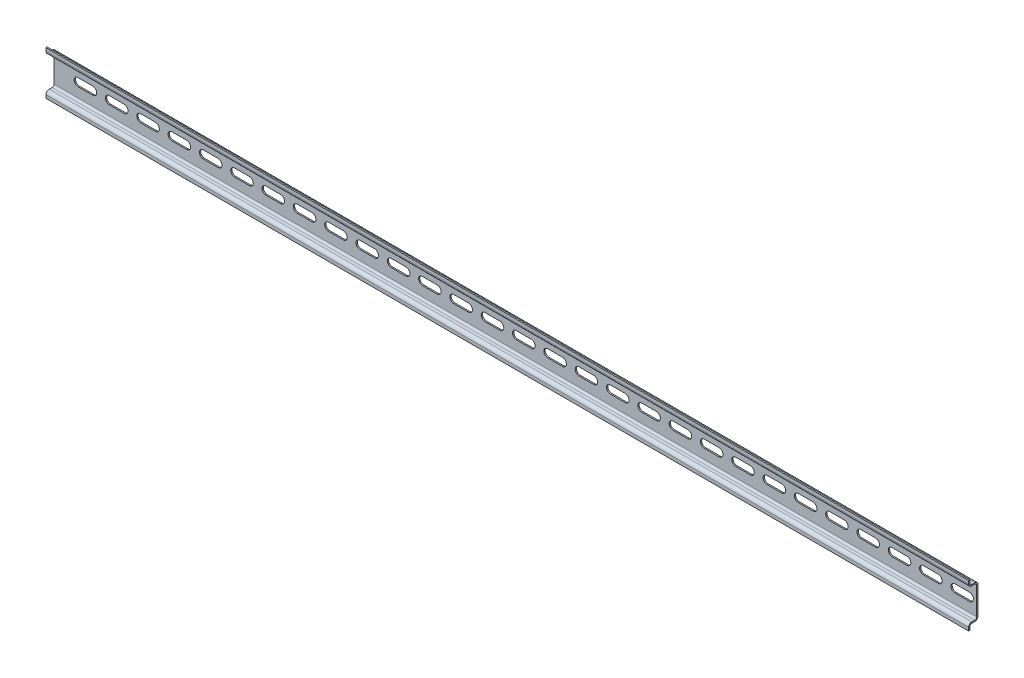
from build123d import *

# Parameters (mm, degrees)
BOSS_EXTRUDE1_DEPTH     = 1000
CUT_EXTRUDE1_DEPTH      = 1001.181688833
FILLET1_R               = 2.54
FILLET2_R               = 1.524
CUT_EXTRUDE2_DEPTH      = 1001.181688833
CUT_EXTRUDE2_DEPTH_BACK = 1001.181688833
SKETCH3_W               = 263.4
SKETCH3_H               = 35.052


with BuildPart() as part:
    # Sketch1 → Boss-Extrude1 (new body)
    with BuildSketch(Plane(origin=(0, 0, 0), x_dir=(0, 0, -1), z_dir=(1, 0, 0))):
        Polygon((0, 12.446), (0, -12.446), (-6.484, -12.446), (-6.484, -17.526), (-5.484, -17.526), (-5.484, -13.462), (1.016, -13.462), (1.016, 13.462), (-5.484, 13.462), (-5.484, 17.526), (-6.484, 17.526), (-6.484, 12.446), align=None)
    extrude(amount=BOSS_EXTRUDE1_DEPTH)

    # Sketch2 → Cut-Extrude1 (cut, through all)
    with BuildSketch(Plane(origin=(0, 0, -1.016), x_dir=(-1, 0, 0), z_dir=(0, 0, -1))):
        with BuildLine():
            Line((-980.825, 3.175), (-969.175, 3.175))
            ThreePointArc((-969.175, 3.175), (-966, 0), (-969.175, -3.175))
            Line((-969.175, -3.175), (-980.825, -3.175))
            ThreePointArc((-980.825, -3.175), (-984, 0), (-980.825, 3.175))
        make_face()
        with BuildLine():
            Line((-955.824999962, 3.175), (-944.174999962, 3.175))
            ThreePointArc((-944.174999962, 3.175), (-940.999999962, 0), (-944.174999962, -3.175))
            Line((-944.174999962, -3.175), (-955.824999962, -3.175))
            ThreePointArc((-955.824999962, -3.175), (-958.999999962, 0), (-955.824999962, 3.175))
        make_face()
        with BuildLine():
            Line((-930.824999924, 3.175), (-919.174999924, 3.175))
            ThreePointArc((-919.174999924, 3.175), (-915.999999924, 0), (-919.174999924, -3.175))
            Line((-919.174999924, -3.175), (-930.824999924, -3.175))
            ThreePointArc((-930.824999924, -3.175), (-933.999999924, 0), (-930.824999924, 3.175))
        make_face()
        with BuildLine():
            Line((-905.824999886, 3.175), (-894.174999886, 3.175))
            ThreePointArc((-894.174999886, 3.175), (-890.999999886, 0), (-894.174999886, -3.175))
            Line((-894.174999886, -3.175), (-905.824999886, -3.175))
            ThreePointArc((-905.824999886, -3.175), (-908.999999886, 0), (-905.824999886, 3.175))
        make_face()
        with BuildLine():
            Line((-880.824999848, 3.175), (-869.174999848, 3.175))
            ThreePointArc((-869.174999848, 3.175), (-865.999999848, 0), (-869.174999848, -3.175))
            Line((-869.174999848, -3.175), (-880.824999848, -3.175))
            ThreePointArc((-880.824999848, -3.175), (-883.999999848, 0), (-880.824999848, 3.175))
        make_face()
        with BuildLine():
            Line((-855.82499981, 3.175), (-844.17499981, 3.175))
            ThreePointArc((-844.17499981, 3.175), (-840.99999981, 0), (-844.17499981, -3.175))
            Line((-844.17499981, -3.175), (-855.82499981, -3.175))
            ThreePointArc((-855.82499981, -3.175), (-858.99999981, 0), (-855.82499981, 3.175))
        make_face()
        with BuildLine():
            Line((-830.824999772, 3.175), (-819.174999772, 3.175))
            ThreePointArc((-819.174999772, 3.175), (-815.999999772, 0), (-819.174999772, -3.175))
            Line((-819.174999772, -3.175), (-830.824999772, -3.175))
            ThreePointArc((-830.824999772, -3.175), (-833.999999772, 0), (-830.824999772, 3.175))
        make_face()
        with BuildLine():
            Line((-805.824999734, 3.175), (-794.174999734, 3.175))
            ThreePointArc((-794.174999734, 3.175), (-790.999999734, 0), (-794.174999734, -3.175))
            Line((-794.174999734, -3.175), (-805.824999734, -3.175))
            ThreePointArc((-805.824999734, -3.175), (-808.999999734, 0), (-805.824999734, 3.175))
        make_face()
        with BuildLine():
            Line((-780.824999696, 3.175), (-769.174999696, 3.175))
            ThreePointArc((-769.174999696, 3.175), (-765.999999696, 0), (-769.174999696, -3.175))
            Line((-769.174999696, -3.175), (-780.824999696, -3.175))
            ThreePointArc((-780.824999696, -3.175), (-783.999999696, 0), (-780.824999696, 3.175))
        make_face()
        with BuildLine():
            Line((-755.824999658, 3.175), (-744.174999658, 3.175))
            ThreePointArc((-744.174999658, 3.175), (-740.999999658, 0), (-744.174999658, -3.175))
            Line((-744.174999658, -3.175), (-755.824999658, -3.175))
            ThreePointArc((-755.824999658, -3.175), (-758.999999658, 0), (-755.824999658, 3.175))
        make_face()
        with BuildLine():
            Line((-730.82499962, 3.175), (-719.17499962, 3.175))
            ThreePointArc((-719.17499962, 3.175), (-715.99999962, 0), (-719.17499962, -3.175))
            Line((-719.17499962, -3.175), (-730.82499962, -3.175))
            ThreePointArc((-730.82499962, -3.175), (-733.99999962, 0), (-730.82499962, 3.175))
        make_face()
        with BuildLine():
            Line((-705.824999582, 3.175), (-694.174999582, 3.175))
            ThreePointArc((-694.174999582, 3.175), (-690.999999582, 0), (-694.174999582, -3.175))
            Line((-694.174999582, -3.175), (-705.824999582, -3.175))
            ThreePointArc((-705.824999582, -3.175), (-708.999999582, 0), (-705.824999582, 3.175))
        make_face()
        with BuildLine():
            Line((-680.824999544, 3.175), (-669.174999544, 3.175))
            ThreePointArc((-669.174999544, 3.175), (-665.999999544, 0), (-669.174999544, -3.175))
            Line((-669.174999544, -3.175), (-680.824999544, -3.175))
            ThreePointArc((-680.824999544, -3.175), (-683.999999544, 0), (-680.824999544, 3.175))
        make_face()
        with BuildLine():
            Line((-655.824999506, 3.175), (-644.174999506, 3.175))
            ThreePointArc((-644.174999506, 3.175), (-640.999999506, 0), (-644.174999506, -3.175))
            Line((-644.174999506, -3.175), (-655.824999506, -3.175))
            ThreePointArc((-655.824999506, -3.175), (-658.999999506, 0), (-655.824999506, 3.175))
        make_face()
        with BuildLine():
            Line((-630.824999468, 3.175), (-619.174999468, 3.175))
            ThreePointArc((-619.174999468, 3.175), (-615.999999468, 0), (-619.174999468, -3.175))
            Line((-619.174999468, -3.175), (-630.824999468, -3.175))
            ThreePointArc((-630.824999468, -3.175), (-633.999999468, 0), (-630.824999468, 3.175))
        make_face()
        with BuildLine():
            Line((-605.82499943, 3.175), (-594.17499943, 3.175))
            ThreePointArc((-594.17499943, 3.175), (-590.99999943, 0), (-594.17499943, -3.175))
            Line((-594.17499943, -3.175), (-605.82499943, -3.175))
            ThreePointArc((-605.82499943, -3.175), (-608.99999943, 0), (-605.82499943, 3.175))
        make_face()
        with BuildLine():
            Line((-580.824999392, 3.175), (-569.174999392, 3.175))
            ThreePointArc((-569.174999392, 3.175), (-565.999999392, 0), (-569.174999392, -3.175))
            Line((-569.174999392, -3.175), (-580.824999392, -3.175))
            ThreePointArc((-580.824999392, -3.175), (-583.999999392, 0), (-580.824999392, 3.175))
        make_face()
        with BuildLine():
            Line((-555.824999354, 3.175), (-544.174999354, 3.175))
            ThreePointArc((-544.174999354, 3.175), (-540.999999354, 0), (-544.174999354, -3.175))
            Line((-544.174999354, -3.175), (-555.824999354, -3.175))
            ThreePointArc((-555.824999354, -3.175), (-558.999999354, 0), (-555.824999354, 3.175))
        make_face()
        with BuildLine():
            Line((-530.824999316, 3.175), (-519.174999316, 3.175))
            ThreePointArc((-519.174999316, 3.175), (-515.999999316, 0), (-519.174999316, -3.175))
            Line((-519.174999316, -3.175), (-530.824999316, -3.175))
            ThreePointArc((-530.824999316, -3.175), (-533.999999316, 0), (-530.824999316, 3.175))
        make_face()
        with BuildLine():
            Line((-505.824999278, 3.175), (-494.174999278, 3.175))
            ThreePointArc((-494.174999278, 3.175), (-490.999999278, 0), (-494.174999278, -3.175))
            Line((-494.174999278, -3.175), (-505.824999278, -3.175))
            ThreePointArc((-505.824999278, -3.175), (-508.999999278, 0), (-505.824999278, 3.175))
        make_face()
        with BuildLine():
            Line((-480.82499924, 3.175), (-469.17499924, 3.175))
            ThreePointArc((-469.17499924, 3.175), (-465.99999924, 0), (-469.17499924, -3.175))
            Line((-469.17499924, -3.175), (-480.82499924, -3.175))
            ThreePointArc((-480.82499924, -3.175), (-483.99999924, 0), (-480.82499924, 3.175))
        make_face()
        with BuildLine():
            Line((-455.824999202, 3.175), (-444.174999202, 3.175))
            ThreePointArc((-444.174999202, 3.175), (-440.999999202, 0), (-444.174999202, -3.175))
            Line((-444.174999202, -3.175), (-455.824999202, -3.175))
            ThreePointArc((-455.824999202, -3.175), (-458.999999202, 0), (-455.824999202, 3.175))
        make_face()
        with BuildLine():
            Line((-430.824999164, 3.175), (-419.174999164, 3.175))
            ThreePointArc((-419.174999164, 3.175), (-415.999999164, 0), (-419.174999164, -3.175))
            Line((-419.174999164, -3.175), (-430.824999164, -3.175))
            ThreePointArc((-430.824999164, -3.175), (-433.999999164, 0), (-430.824999164, 3.175))
        make_face()
        with BuildLine():
            Line((-405.824999126, 3.175), (-394.174999126, 3.175))
            ThreePointArc((-394.174999126, 3.175), (-390.999999126, 0), (-394.174999126, -3.175))
            Line((-394.174999126, -3.175), (-405.824999126, -3.175))
            ThreePointArc((-405.824999126, -3.175), (-408.999999126, 0), (-405.824999126, 3.175))
        make_face()
        with BuildLine():
            Line((-380.824999088, 3.175), (-369.174999088, 3.175))
            ThreePointArc((-369.174999088, 3.175), (-365.999999088, 0), (-369.174999088, -3.175))
            Line((-369.174999088, -3.175), (-380.824999088, -3.175))
            ThreePointArc((-380.824999088, -3.175), (-383.999999088, 0), (-380.824999088, 3.175))
        make_face()
        with BuildLine():
            Line((-355.82499905, 3.175), (-344.17499905, 3.175))
            ThreePointArc((-344.17499905, 3.175), (-340.99999905, 0), (-344.17499905, -3.175))
            Line((-344.17499905, -3.175), (-355.82499905, -3.175))
            ThreePointArc((-355.82499905, -3.175), (-358.99999905, 0), (-355.82499905, 3.175))
        make_face()
        with BuildLine():
            Line((-330.824999012, 3.175), (-319.174999012, 3.175))
            ThreePointArc((-319.174999012, 3.175), (-315.999999012, 0), (-319.174999012, -3.175))
            Line((-319.174999012, -3.175), (-330.824999012, -3.175))
            ThreePointArc((-330.824999012, -3.175), (-333.999999012, 0), (-330.824999012, 3.175))
        make_face()
        with BuildLine():
            Line((-305.824998974, 3.175), (-294.174998974, 3.175))
            ThreePointArc((-294.174998974, 3.175), (-290.999998974, 0), (-294.174998974, -3.175))
            Line((-294.174998974, -3.175), (-305.824998974, -3.175))
            ThreePointArc((-305.824998974, -3.175), (-308.999998974, 0), (-305.824998974, 3.175))
        make_face()
        with BuildLine():
            Line((-280.824998936, 3.175), (-269.174998936, 3.175))
            ThreePointArc((-269.174998936, 3.175), (-265.999998936, 0), (-269.174998936, -3.175))
            Line((-269.174998936, -3.175), (-280.824998936, -3.175))
            ThreePointArc((-280.824998936, -3.175), (-283.999998936, 0), (-280.824998936, 3.175))
        make_face()
        with BuildLine():
            Line((-255.824998898, 3.175), (-244.174998898, 3.175))
            ThreePointArc((-244.174998898, 3.175), (-240.999998898, 0), (-244.174998898, -3.175))
            Line((-244.174998898, -3.175), (-255.824998898, -3.175))
            ThreePointArc((-255.824998898, -3.175), (-258.999998898, 0), (-255.824998898, 3.175))
        make_face()
        with BuildLine():
            Line((-230.82499886, 3.175), (-219.17499886, 3.175))
            ThreePointArc((-219.17499886, 3.175), (-215.99999886, 0), (-219.17499886, -3.175))
            Line((-219.17499886, -3.175), (-230.82499886, -3.175))
            ThreePointArc((-230.82499886, -3.175), (-233.99999886, 0), (-230.82499886, 3.175))
        make_face()
        with BuildLine():
            Line((-205.824998822, 3.175), (-194.174998822, 3.175))
            ThreePointArc((-194.174998822, 3.175), (-190.999998822, 0), (-194.174998822, -3.175))
            Line((-194.174998822, -3.175), (-205.824998822, -3.175))
            ThreePointArc((-205.824998822, -3.175), (-208.999998822, 0), (-205.824998822, 3.175))
        make_face()
        with BuildLine():
            Line((-180.824998784, 3.175), (-169.174998784, 3.175))
            ThreePointArc((-169.174998784, 3.175), (-165.999998784, 0), (-169.174998784, -3.175))
            Line((-169.174998784, -3.175), (-180.824998784, -3.175))
            ThreePointArc((-180.824998784, -3.175), (-183.999998784, 0), (-180.824998784, 3.175))
        make_face()
        with BuildLine():
            Line((-155.824998746, 3.175), (-144.174998746, 3.175))
            ThreePointArc((-144.174998746, 3.175), (-140.999998746, 0), (-144.174998746, -3.175))
            Line((-144.174998746, -3.175), (-155.824998746, -3.175))
            ThreePointArc((-155.824998746, -3.175), (-158.999998746, 0), (-155.824998746, 3.175))
        make_face()
        with BuildLine():
            Line((-130.824998708, 3.175), (-119.174998708, 3.175))
            ThreePointArc((-119.174998708, 3.175), (-115.999998708, 0), (-119.174998708, -3.175))
            Line((-119.174998708, -3.175), (-130.824998708, -3.175))
            ThreePointArc((-130.824998708, -3.175), (-133.999998708, 0), (-130.824998708, 3.175))
        make_face()
        with BuildLine():
            Line((-105.82499867, 3.175), (-94.17499867, 3.175))
            ThreePointArc((-94.17499867, 3.175), (-90.99999867, 0), (-94.17499867, -3.175))
            Line((-94.17499867, -3.175), (-105.82499867, -3.175))
            ThreePointArc((-105.82499867, -3.175), (-108.99999867, 0), (-105.82499867, 3.175))
        make_face()
        with BuildLine():
            Line((-80.824998632, 3.175), (-69.174998632, 3.175))
            ThreePointArc((-69.174998632, 3.175), (-65.999998632, 0), (-69.174998632, -3.175))
            Line((-69.174998632, -3.175), (-80.824998632, -3.175))
            ThreePointArc((-80.824998632, -3.175), (-83.999998632, 0), (-80.824998632, 3.175))
        make_face()
        with BuildLine():
            Line((-55.824998594, 3.175), (-44.174998594, 3.175))
            ThreePointArc((-44.174998594, 3.175), (-40.999998594, 0), (-44.174998594, -3.175))
            Line((-44.174998594, -3.175), (-55.824998594, -3.175))
            ThreePointArc((-55.824998594, -3.175), (-58.999998594, 0), (-55.824998594, 3.175))
        make_face()
        with BuildLine():
            Line((-30.824998556, 3.175), (-19.174998556, 3.175))
            ThreePointArc((-19.174998556, 3.175), (-15.999998556, 0), (-19.174998556, -3.175))
            Line((-19.174998556, -3.175), (-30.824998556, -3.175))
            ThreePointArc((-30.824998556, -3.175), (-33.999998556, 0), (-30.824998556, 3.175))
        make_face()
    extrude(amount=-CUT_EXTRUDE1_DEPTH, mode=Mode.SUBTRACT)

    # Fillet1
    fillet1_edges = [part.edges().sort_by_distance(p)[0] for p in [
        (500, 13.462, -1.016),
        (500, -13.462, -1.016),
        (500, -12.446, 6.484),
        (500, 12.446, 6.484),
    ]]
    fillet(fillet1_edges, radius=FILLET1_R)

    # Fillet2
    fillet2_edges = [part.edges().sort_by_distance(p)[0] for p in [
        (500, 13.462, 5.484),
        (500, -13.462, 5.484),
        (500, -12.446, 0),
        (500, 12.446, 0),
    ]]
    fillet(fillet2_edges, radius=FILLET2_R)

    # Sketch3 → Cut-Extrude2 (cut, two sides: drawn at the far end of the back side and taken through both)
    with BuildSketch(Plane(origin=(0, 0, -1.016), x_dir=(-1, 0, 0), z_dir=(0, 0, -1)).offset(-CUT_EXTRUDE2_DEPTH_BACK)):
        with Locations((-868.3, 0)):
            Rectangle(SKETCH3_W, SKETCH3_H)
    extrude(amount=CUT_EXTRUDE2_DEPTH + CUT_EXTRUDE2_DEPTH_BACK, mode=Mode.SUBTRACT)


solid = part.part
